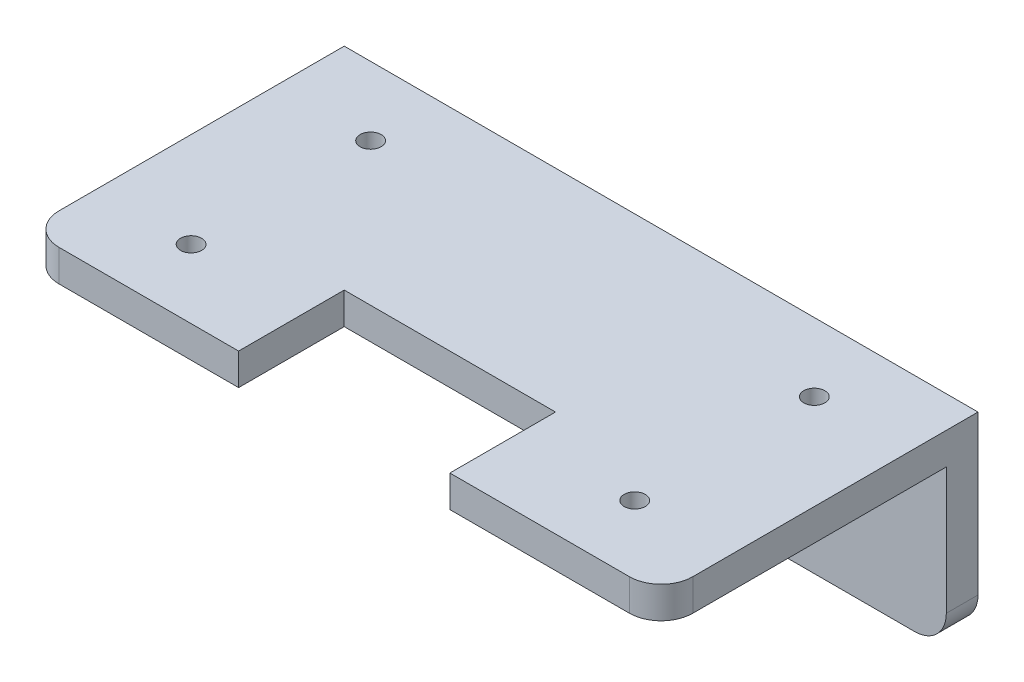
from build123d import *

# Parameters (mm, degrees)
SKETCH1_W           = 60
SKETCH1_H           = 3
BOSS_EXTRUDE1_DEPTH = 30
SKETCH2_W           = 60
SKETCH2_H           = 3
BOSS_EXTRUDE2_DEPTH = 15
SKETCH3_W           = 20
SKETCH3_H           = 10
CUT_EXTRUDE1_DEPTH  = 46
FILLET1_R           = 3
SKETCH4_R           = 1
CUT_EXTRUDE2_DEPTH  = 10


with BuildPart() as part:
    # Sketch1 → Boss-Extrude1 (new body)
    with BuildSketch(Plane.XY):
        with Locations((0, 158.5)):
            Rectangle(SKETCH1_W, SKETCH1_H)
    extrude(amount=BOSS_EXTRUDE1_DEPTH)

    # Sketch2 → Boss-Extrude2 (add)
    with BuildSketch(Plane.XZ.offset(-157)):
        with Locations((0, 1.5)):
            Rectangle(SKETCH2_W, SKETCH2_H)
    extrude(amount=BOSS_EXTRUDE2_DEPTH)

    # Sketch3 → Cut-Extrude1 (cut, through all)
    with BuildSketch(Plane.XZ.offset(-157)):
        with Locations((0, 25)):
            Rectangle(SKETCH3_W, SKETCH3_H)
    extrude(amount=-CUT_EXTRUDE1_DEPTH, mode=Mode.SUBTRACT)

    # Fillet1
    fillet1_edges = [part.edges().sort_by_distance(p)[0] for p in [
        (30, 158.5, 30),
        (-30, 142, 1.5),
        (30, 142, 1.5),
        (-30, 158.5, 30),
    ]]
    fillet(fillet1_edges, radius=FILLET1_R)

    # Sketch4 → Cut-Extrude2 (cut)
    with BuildSketch(Plane(origin=(0, 160, 0), x_dir=(1, 0, 0), z_dir=(0, 1, 0))):
        with Locations(Location((-21, -23.5, 0), (0, 0, 270))):
            Circle(SKETCH4_R)
        with Locations(Location((-21, -6.5, 0), (0, 0, 270))):
            Circle(SKETCH4_R)
        with Locations(Location((21, -6.5, 0), (0, 0, 270))):
            Circle(SKETCH4_R)
        with Locations(Location((21, -23.5, 0), (0, 0, 270))):
            Circle(SKETCH4_R)
    extrude(amount=-CUT_EXTRUDE2_DEPTH, mode=Mode.SUBTRACT)


solid = part.part
